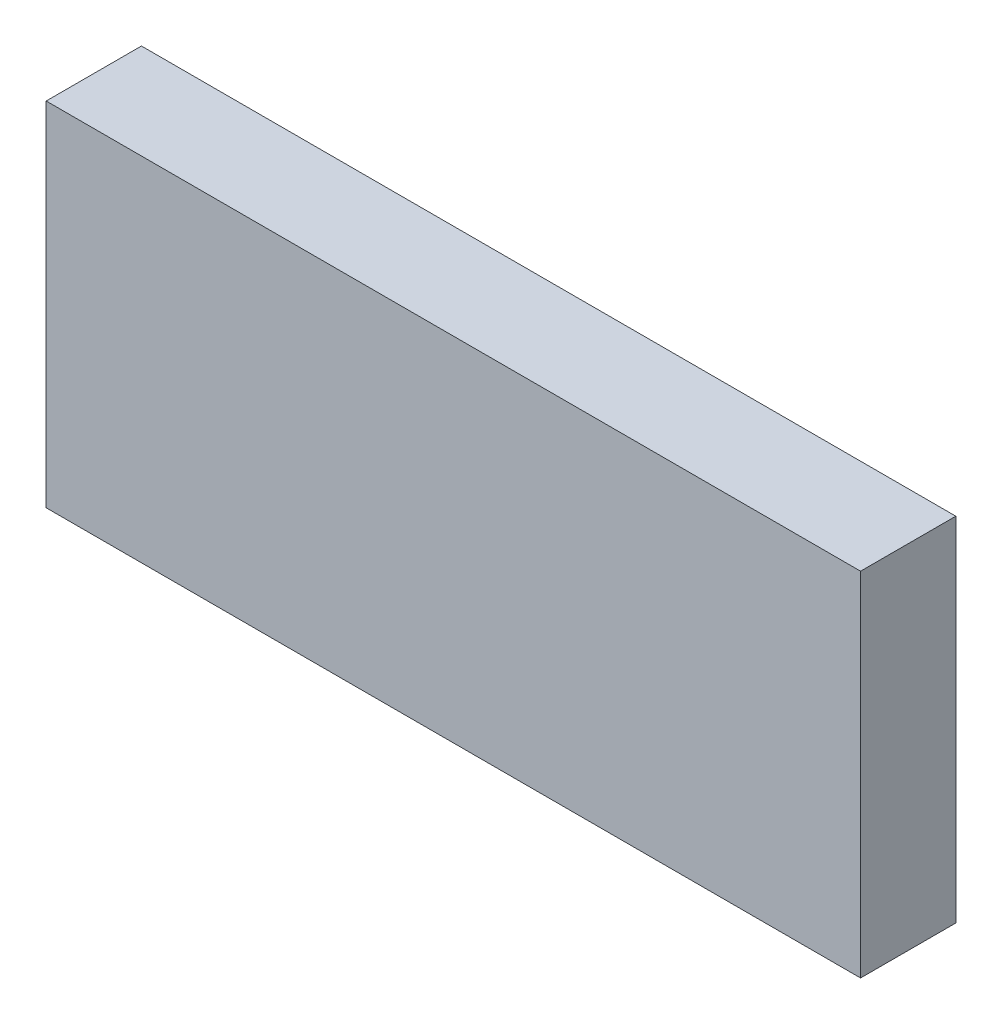
from build123d import *

# Parameters (mm, degrees)
SKETCH1_W           = 36.988537316
SKETCH1_H           = 85.498094454
BOSS_EXTRUDE1_DEPTH = 10


with BuildPart() as part:
    # Sketch1 → Boss-Extrude1 (new body)
    with BuildSketch(Plane(origin=(0, 0, 0), x_dir=(0, 1, 0), z_dir=(0, 0, 1))):
        Rectangle(SKETCH1_W, SKETCH1_H)
    extrude(amount=BOSS_EXTRUDE1_DEPTH)


solid = part.part
